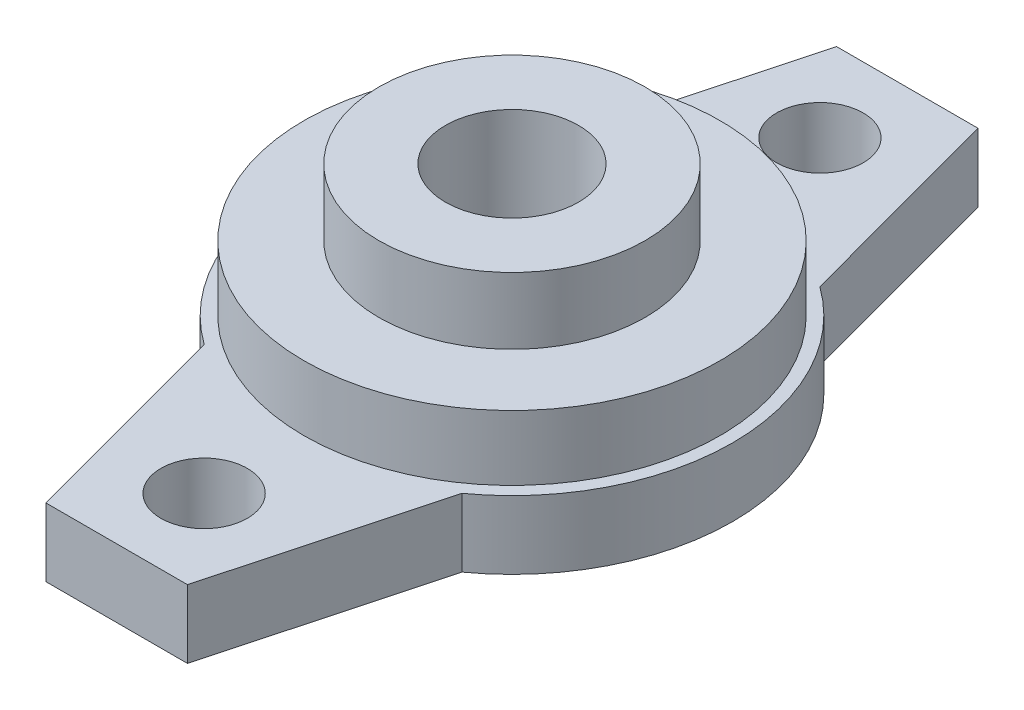
from build123d import *

# Parameters (mm, degrees)
SKETCH1_R                = 13.25
SKETCH1_R_2              = 2.6
BOSS_EXTRUDE1_DEPTH      = 4.1
BOSS_EXTRUDE2_DEPTH      = 3.9
BOSS_EXTRUDE2_DEPTH_BACK = 4.1
SKETCH2_R                = 12.5
BOSS_EXTRUDE3_DEPTH      = 4
BOSS_EXTRUDE3_DEPTH_BACK = 3.9
SKETCH3_R                = 8
SKETCH4_R                = 4
CUT_EXTRUDE1_DEPTH       = 30.725830518


with BuildPart() as part:
    # Sketch1 → Boss-Extrude1 (new body)
    # profile 1 of 3: a face of its own
    with BuildSketch(Plane(origin=(0, 0, 0), x_dir=(1, 0, 0), z_dir=(0, 1, 0))):
        Circle(SKETCH1_R)
    # profile 2 of 3: a face of its own
    with BuildSketch(Plane(origin=(0, 0, 0), x_dir=(1, 0, 0), z_dir=(0, 1, 0))):
        with BuildLine():
            Line((7.745966692, 10.75), (4.25, 23.75))
            Line((4.25, 23.75), (-4.25, 23.75))
            Line((-4.25, 23.75), (-7.745966692, 10.75))
            ThreePointArc((-7.745966692, 10.75), (0, 13.25), (7.745966692, 10.75))
        make_face()
        with Locations(Location((0, 18.5, 0), (0, 0, 270))):
            Circle(SKETCH1_R_2, mode=Mode.SUBTRACT)
    # profile 3 of 3: a face of its own
    with BuildSketch(Plane(origin=(0, 0, 0), x_dir=(1, 0, 0), z_dir=(0, 1, 0))):
        with BuildLine():
            Line((4.25, -23.75), (7.745966692, -10.75))
            ThreePointArc((7.745966692, -10.75), (0, -13.25), (-7.745966692, -10.75))
            Line((-7.745966692, -10.75), (-4.25, -23.75))
            Line((-4.25, -23.75), (4.25, -23.75))
        make_face()
        with Locations(Location((0, -18.5, 0), (0, 0, 270))):
            Circle(SKETCH1_R_2, mode=Mode.SUBTRACT)
    extrude(amount=BOSS_EXTRUDE1_DEPTH)

    # Sketch2 → Boss-Extrude2 (add, two sides: drawn at the far end of the back side and taken through both)
    with BuildSketch(Plane(origin=(0, 4.1, 0), x_dir=(1, 0, 0), z_dir=(0, 1, 0)).offset(-BOSS_EXTRUDE2_DEPTH_BACK)):
        with Locations(Location((0, 0, 0), (0, 0, 270))):
            Circle(SKETCH2_R)
    extrude(amount=BOSS_EXTRUDE2_DEPTH + BOSS_EXTRUDE2_DEPTH_BACK)

    # Sketch3 → Boss-Extrude3 (add, two sides: drawn at the far end of the back side and taken through both)
    with BuildSketch(Plane(origin=(0, 8, 0), x_dir=(1, 0, 0), z_dir=(0, 1, 0)).offset(-BOSS_EXTRUDE3_DEPTH_BACK)):
        with Locations(Location((0, 0, 0), (0, 0, 270))):
            Circle(SKETCH3_R)
    extrude(amount=BOSS_EXTRUDE3_DEPTH + BOSS_EXTRUDE3_DEPTH_BACK)

    # Sketch4 → Cut-Extrude1 (cut, through all)
    with BuildSketch(Plane(origin=(0, 12, 0), x_dir=(1, 0, 0), z_dir=(0, 1, 0))):
        with Locations(Location((0, 0, 0), (0, 0, 270))):
            Circle(SKETCH4_R)
    extrude(amount=-CUT_EXTRUDE1_DEPTH, mode=Mode.SUBTRACT)


solid = part.part
